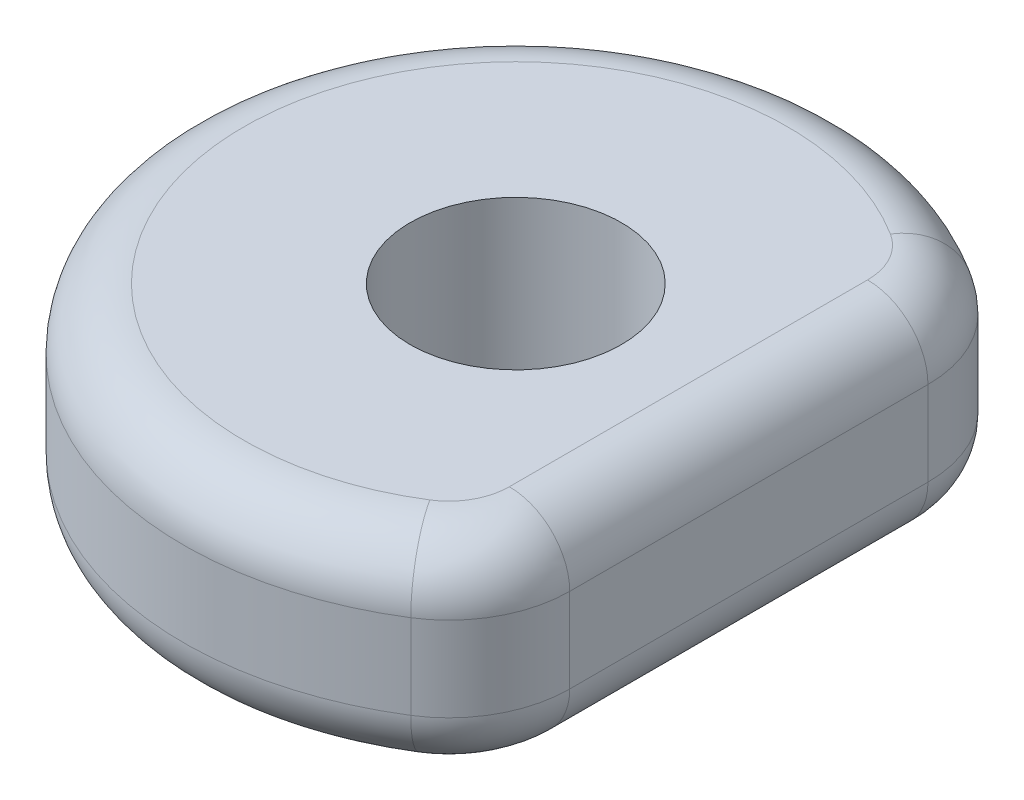
from build123d import *

# Parameters (mm, degrees)
CROQUIS1_R              = 1.75
SALIENTE_EXTRUIR1_DEPTH = 3.4
REDONDEO1_R             = 2
REDONDEO2_R             = 1


with BuildPart() as part:
    # Croquis1 → Saliente-Extruir1 (new body)
    with BuildSketch(Plane(origin=(0, 0, 0), x_dir=(1, 0, 0), z_dir=(0, 1, 0))):
        with BuildLine():
            Line((3.858987824, 3.918955597), (3.858987824, -3.918955597))
            ThreePointArc((3.858987824, -3.918955597), (-5.5, 0), (3.858987824, 3.918955597))
        make_face()
        with Locations(Location((0, 0, 0), (0, 0, 270))):
            Circle(CROQUIS1_R, mode=Mode.SUBTRACT)
    extrude(amount=SALIENTE_EXTRUIR1_DEPTH)

    # Redondeo1
    redondeo1_edges = [part.edges().sort_by_distance(p)[0] for p in [
        (3.858987824, 1.7, -3.918955597),
        (3.858987824, 1.7, 3.918955597),
    ]]
    fillet(redondeo1_edges, radius=REDONDEO1_R)

    # Redondeo2
    redondeo2_edges = [part.edges().sort_by_distance(p)[0] for p in [
        (3.858987824, 0, 0),
        (3.858987824, 3.4, 0),
        (-5.5, 0, 0),
        (3.60892461, 0, -3.933855699),
        (3.60892461, 0, 3.933855699),
        (-5.5, 3.4, 0),
        (3.60892461, 3.4, -3.933855699),
        (3.60892461, 3.4, 3.933855699),
    ]]
    fillet(redondeo2_edges, radius=REDONDEO2_R)


solid = part.part
